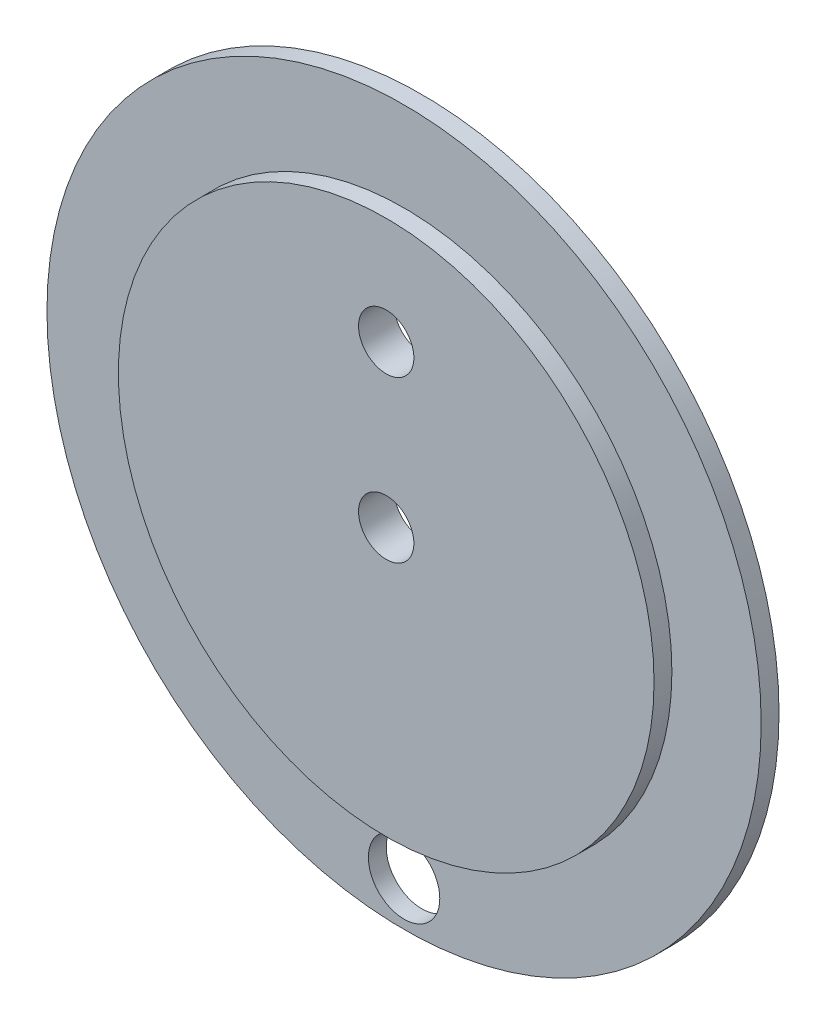
from build123d import *

# Parameters (mm, degrees)
SKETCH1_R           = 20
SKETCH1_R_2         = 2
SKETCH1_R_3         = 15
BOSS_EXTRUDE1_DEPTH = 1
SKETCH1_4_R         = 15
SKETCH1_4_R_2       = 1.55
BOSS_EXTRUDE2_DEPTH = 2


with BuildPart() as part:
    # Sketch1 → Boss-Extrude1 (new body)
    with BuildSketch(Plane(origin=(0, 0, 0), x_dir=(0, 1, 0), z_dir=(0, 0, 1))):
        Circle(SKETCH1_R)
        with Locations((-17.5, 0)):
            Circle(SKETCH1_R_2, mode=Mode.SUBTRACT)
        Circle(SKETCH1_R_3, mode=Mode.SUBTRACT)
    extrude(amount=BOSS_EXTRUDE1_DEPTH)

    # Sketch1<4> → Boss-Extrude2 (add)
    with BuildSketch(Plane(origin=(0, 0, 0), x_dir=(0, 1, 0), z_dir=(0, 0, 1))):
        Circle(SKETCH1_4_R)
        Circle(SKETCH1_4_R_2, mode=Mode.SUBTRACT)
        with Locations((9, 0)):
            Circle(SKETCH1_4_R_2, mode=Mode.SUBTRACT)
    extrude(amount=BOSS_EXTRUDE2_DEPTH)


solid = part.part
